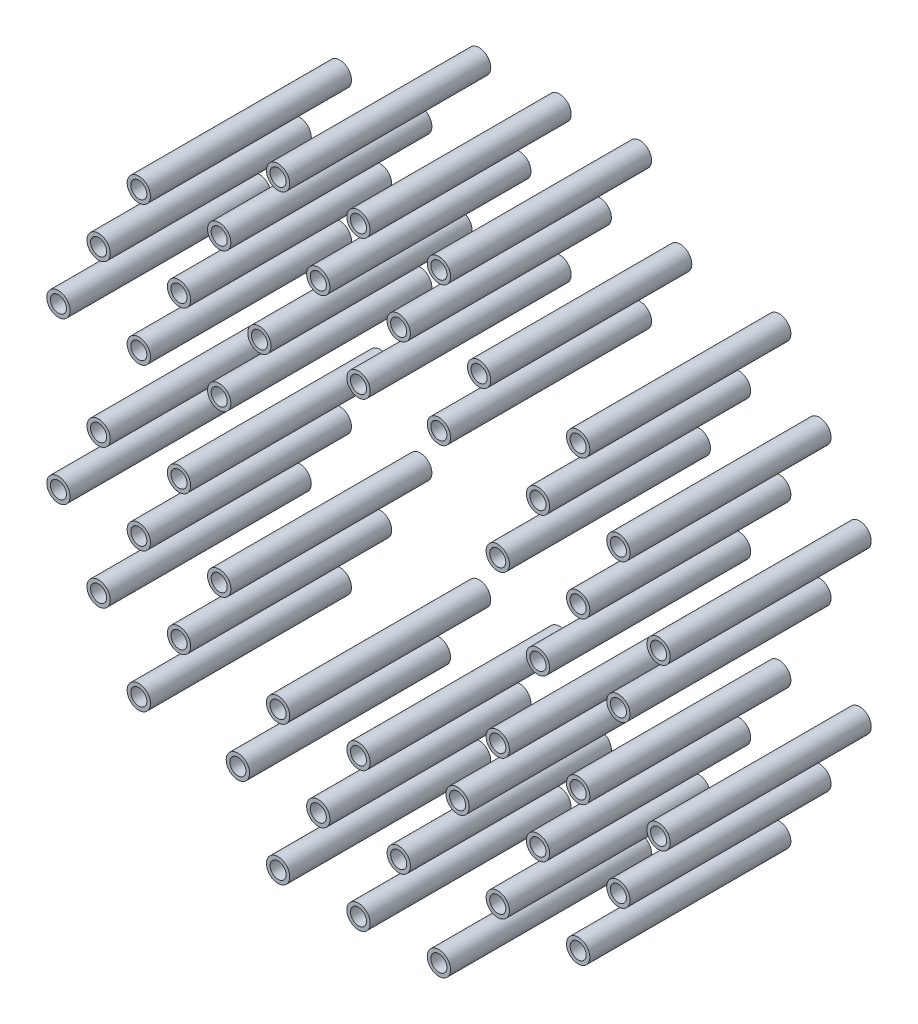
from build123d import *

# Parameters (mm, degrees)
SKETCH1_R             = 0.7366
SKETCH1_R_2           = 0.508
BOSS_EXTRUDE1_DEPTH   = 12.7
BOSS_EXTRUDE1_2_DEPTH = 12.7
BOSS_EXTRUDE1_3_DEPTH = 12.7
BOSS_EXTRUDE1_4_DEPTH = 12.7
BOSS_EXTRUDE1_5_DEPTH = 12.7
BOSS_EXTRUDE1_6_DEPTH = 12.7
BOSS_EXTRUDE1_7_DEPTH = 12.7
BOSS_EXTRUDE1_8_DEPTH = 12.7
CIRPATTERN2_COUNT     = 6


with BuildPart() as part:
    # Sketch1 → Boss-Extrude1 (new body)
    with BuildSketch(Plane.XY):
        with Locations((0, 10.16)):
            Circle(SKETCH1_R)
        with Locations((0, 10.16)):
            Circle(SKETCH1_R_2, mode=Mode.SUBTRACT)
    extrude(amount=BOSS_EXTRUDE1_DEPTH)


with BuildPart() as body_2:
    # Sketch1 → Boss-Extrude1 2 (new body)
    with BuildSketch(Plane.XY):
        with Locations((5.08, 10.16)):
            Circle(SKETCH1_R)
        with Locations((5.08, 10.16)):
            Circle(SKETCH1_R_2, mode=Mode.SUBTRACT)
    extrude(amount=BOSS_EXTRUDE1_2_DEPTH)


with BuildPart() as body_3:
    # Sketch1 → Boss-Extrude1 3 (new body)
    with BuildSketch(Plane.XY):
        with Locations((7.62, 14.559409051)):
            Circle(SKETCH1_R)
        with Locations((7.62, 14.559409051)):
            Circle(SKETCH1_R_2, mode=Mode.SUBTRACT)
    extrude(amount=BOSS_EXTRUDE1_3_DEPTH)


with BuildPart() as body_4:
    # Sketch1 → Boss-Extrude1 4 (new body)
    with BuildSketch(Plane.XY):
        with Locations((2.54, 14.559409051)):
            Circle(SKETCH1_R)
        with Locations((2.54, 14.559409051)):
            Circle(SKETCH1_R_2, mode=Mode.SUBTRACT)
    extrude(amount=BOSS_EXTRUDE1_4_DEPTH)


with BuildPart() as body_5:
    # Sketch1 → Boss-Extrude1 5 (new body)
    with BuildSketch(Plane.XY):
        with Locations((-2.54, 14.559409051)):
            Circle(SKETCH1_R)
        with Locations((-2.54, 14.559409051)):
            Circle(SKETCH1_R_2, mode=Mode.SUBTRACT)
    extrude(amount=BOSS_EXTRUDE1_5_DEPTH)


with BuildPart() as body_6:
    # Sketch1 → Boss-Extrude1 6 (new body)
    with BuildSketch(Plane.XY):
        with Locations((0, 18.958818102)):
            Circle(SKETCH1_R)
        with Locations((0, 18.958818102)):
            Circle(SKETCH1_R_2, mode=Mode.SUBTRACT)
    extrude(amount=BOSS_EXTRUDE1_6_DEPTH)


with BuildPart() as body_7:
    # Sketch1 → Boss-Extrude1 7 (new body)
    with BuildSketch(Plane.XY):
        with Locations((5.08, 18.958818102)):
            Circle(SKETCH1_R)
        with Locations((5.08, 18.958818102)):
            Circle(SKETCH1_R_2, mode=Mode.SUBTRACT)
    extrude(amount=BOSS_EXTRUDE1_7_DEPTH)


with BuildPart() as body_8:
    # Sketch1 → Boss-Extrude1 8 (new body)
    with BuildSketch(Plane.XY):
        with Locations((-5.08, 18.958818102)):
            Circle(SKETCH1_R)
        with Locations((-5.08, 18.958818102)):
            Circle(SKETCH1_R_2, mode=Mode.SUBTRACT)
    extrude(amount=BOSS_EXTRUDE1_8_DEPTH)


with BuildPart() as cirpattern2_1:
    # CirPattern2: pattern copy
    add(body_8.part.rotate(Axis((0, 0, 13.335), (0, 0, -1)), 1 * 360 / CIRPATTERN2_COUNT))


with BuildPart() as cirpattern2_2:
    # CirPattern2: pattern copy
    add(body_8.part.rotate(Axis((0, 0, 13.335), (0, 0, -1)), 2 * 360 / CIRPATTERN2_COUNT))


with BuildPart() as cirpattern2_3:
    # CirPattern2: pattern copy
    add(body_8.part.rotate(Axis((0, 0, 13.335), (0, 0, -1)), 3 * 360 / CIRPATTERN2_COUNT))


with BuildPart() as cirpattern2_4:
    # CirPattern2: pattern copy
    add(body_8.part.rotate(Axis((0, 0, 13.335), (0, 0, -1)), 4 * 360 / CIRPATTERN2_COUNT))


with BuildPart() as cirpattern2_5:
    # CirPattern2: pattern copy
    add(body_8.part.rotate(Axis((0, 0, 13.335), (0, 0, -1)), 5 * 360 / CIRPATTERN2_COUNT))


with BuildPart() as cirpattern2_6:
    # CirPattern2: pattern copy
    add(body_7.part.rotate(Axis((0, 0, 13.335), (0, 0, -1)), 1 * 360 / CIRPATTERN2_COUNT))


with BuildPart() as cirpattern2_7:
    # CirPattern2: pattern copy
    add(body_7.part.rotate(Axis((0, 0, 13.335), (0, 0, -1)), 2 * 360 / CIRPATTERN2_COUNT))


with BuildPart() as cirpattern2_8:
    # CirPattern2: pattern copy
    add(body_7.part.rotate(Axis((0, 0, 13.335), (0, 0, -1)), 3 * 360 / CIRPATTERN2_COUNT))


with BuildPart() as cirpattern2_9:
    # CirPattern2: pattern copy
    add(body_7.part.rotate(Axis((0, 0, 13.335), (0, 0, -1)), 4 * 360 / CIRPATTERN2_COUNT))


with BuildPart() as cirpattern2_10:
    # CirPattern2: pattern copy
    add(body_7.part.rotate(Axis((0, 0, 13.335), (0, 0, -1)), 5 * 360 / CIRPATTERN2_COUNT))


with BuildPart() as cirpattern2_11:
    # CirPattern2: pattern copy
    add(body_6.part.rotate(Axis((0, 0, 13.335), (0, 0, -1)), 1 * 360 / CIRPATTERN2_COUNT))


with BuildPart() as cirpattern2_12:
    # CirPattern2: pattern copy
    add(body_6.part.rotate(Axis((0, 0, 13.335), (0, 0, -1)), 2 * 360 / CIRPATTERN2_COUNT))


with BuildPart() as cirpattern2_13:
    # CirPattern2: pattern copy
    add(body_6.part.rotate(Axis((0, 0, 13.335), (0, 0, -1)), 3 * 360 / CIRPATTERN2_COUNT))


with BuildPart() as cirpattern2_14:
    # CirPattern2: pattern copy
    add(body_6.part.rotate(Axis((0, 0, 13.335), (0, 0, -1)), 4 * 360 / CIRPATTERN2_COUNT))


with BuildPart() as cirpattern2_15:
    # CirPattern2: pattern copy
    add(body_6.part.rotate(Axis((0, 0, 13.335), (0, 0, -1)), 5 * 360 / CIRPATTERN2_COUNT))


with BuildPart() as cirpattern2_16:
    # CirPattern2: pattern copy
    add(body_5.part.rotate(Axis((0, 0, 13.335), (0, 0, -1)), 1 * 360 / CIRPATTERN2_COUNT))


with BuildPart() as cirpattern2_17:
    # CirPattern2: pattern copy
    add(body_5.part.rotate(Axis((0, 0, 13.335), (0, 0, -1)), 2 * 360 / CIRPATTERN2_COUNT))


with BuildPart() as cirpattern2_18:
    # CirPattern2: pattern copy
    add(body_5.part.rotate(Axis((0, 0, 13.335), (0, 0, -1)), 3 * 360 / CIRPATTERN2_COUNT))


with BuildPart() as cirpattern2_19:
    # CirPattern2: pattern copy
    add(body_5.part.rotate(Axis((0, 0, 13.335), (0, 0, -1)), 4 * 360 / CIRPATTERN2_COUNT))


with BuildPart() as cirpattern2_20:
    # CirPattern2: pattern copy
    add(body_5.part.rotate(Axis((0, 0, 13.335), (0, 0, -1)), 5 * 360 / CIRPATTERN2_COUNT))


with BuildPart() as cirpattern2_21:
    # CirPattern2: pattern copy
    add(body_4.part.rotate(Axis((0, 0, 13.335), (0, 0, -1)), 1 * 360 / CIRPATTERN2_COUNT))


with BuildPart() as cirpattern2_22:
    # CirPattern2: pattern copy
    add(body_4.part.rotate(Axis((0, 0, 13.335), (0, 0, -1)), 2 * 360 / CIRPATTERN2_COUNT))


with BuildPart() as cirpattern2_23:
    # CirPattern2: pattern copy
    add(body_4.part.rotate(Axis((0, 0, 13.335), (0, 0, -1)), 3 * 360 / CIRPATTERN2_COUNT))


with BuildPart() as cirpattern2_24:
    # CirPattern2: pattern copy
    add(body_4.part.rotate(Axis((0, 0, 13.335), (0, 0, -1)), 4 * 360 / CIRPATTERN2_COUNT))


with BuildPart() as cirpattern2_25:
    # CirPattern2: pattern copy
    add(body_4.part.rotate(Axis((0, 0, 13.335), (0, 0, -1)), 5 * 360 / CIRPATTERN2_COUNT))


with BuildPart() as cirpattern2_26:
    # CirPattern2: pattern copy
    add(body_3.part.rotate(Axis((0, 0, 13.335), (0, 0, -1)), 1 * 360 / CIRPATTERN2_COUNT))


with BuildPart() as cirpattern2_27:
    # CirPattern2: pattern copy
    add(body_3.part.rotate(Axis((0, 0, 13.335), (0, 0, -1)), 2 * 360 / CIRPATTERN2_COUNT))


with BuildPart() as cirpattern2_28:
    # CirPattern2: pattern copy
    add(body_3.part.rotate(Axis((0, 0, 13.335), (0, 0, -1)), 3 * 360 / CIRPATTERN2_COUNT))


with BuildPart() as cirpattern2_29:
    # CirPattern2: pattern copy
    add(body_3.part.rotate(Axis((0, 0, 13.335), (0, 0, -1)), 4 * 360 / CIRPATTERN2_COUNT))


with BuildPart() as cirpattern2_30:
    # CirPattern2: pattern copy
    add(body_3.part.rotate(Axis((0, 0, 13.335), (0, 0, -1)), 5 * 360 / CIRPATTERN2_COUNT))


with BuildPart() as cirpattern2_31:
    # CirPattern2: pattern copy
    add(body_2.part.rotate(Axis((0, 0, 13.335), (0, 0, -1)), 1 * 360 / CIRPATTERN2_COUNT))


with BuildPart() as cirpattern2_32:
    # CirPattern2: pattern copy
    add(body_2.part.rotate(Axis((0, 0, 13.335), (0, 0, -1)), 2 * 360 / CIRPATTERN2_COUNT))


with BuildPart() as cirpattern2_33:
    # CirPattern2: pattern copy
    add(body_2.part.rotate(Axis((0, 0, 13.335), (0, 0, -1)), 3 * 360 / CIRPATTERN2_COUNT))


with BuildPart() as cirpattern2_34:
    # CirPattern2: pattern copy
    add(body_2.part.rotate(Axis((0, 0, 13.335), (0, 0, -1)), 4 * 360 / CIRPATTERN2_COUNT))


with BuildPart() as cirpattern2_35:
    # CirPattern2: pattern copy
    add(body_2.part.rotate(Axis((0, 0, 13.335), (0, 0, -1)), 5 * 360 / CIRPATTERN2_COUNT))


with BuildPart() as cirpattern2_36:
    # CirPattern2: pattern copy
    add(part.part.rotate(Axis((0, 0, 13.335), (0, 0, -1)), 1 * 360 / CIRPATTERN2_COUNT))


with BuildPart() as cirpattern2_37:
    # CirPattern2: pattern copy
    add(part.part.rotate(Axis((0, 0, 13.335), (0, 0, -1)), 2 * 360 / CIRPATTERN2_COUNT))


with BuildPart() as cirpattern2_38:
    # CirPattern2: pattern copy
    add(part.part.rotate(Axis((0, 0, 13.335), (0, 0, -1)), 3 * 360 / CIRPATTERN2_COUNT))


with BuildPart() as cirpattern2_39:
    # CirPattern2: pattern copy
    add(part.part.rotate(Axis((0, 0, 13.335), (0, 0, -1)), 4 * 360 / CIRPATTERN2_COUNT))


with BuildPart() as cirpattern2_40:
    # CirPattern2: pattern copy
    add(part.part.rotate(Axis((0, 0, 13.335), (0, 0, -1)), 5 * 360 / CIRPATTERN2_COUNT))


solid = Compound([part.part, body_2.part, body_3.part, body_4.part, body_5.part, body_6.part, body_7.part, body_8.part, cirpattern2_1.part, cirpattern2_2.part, cirpattern2_3.part, cirpattern2_4.part, cirpattern2_5.part, cirpattern2_6.part, cirpattern2_7.part, cirpattern2_8.part, cirpattern2_9.part, cirpattern2_10.part, cirpattern2_11.part, cirpattern2_12.part, cirpattern2_13.part, cirpattern2_14.part, cirpattern2_15.part, cirpattern2_16.part, cirpattern2_17.part, cirpattern2_18.part, cirpattern2_19.part, cirpattern2_20.part, cirpattern2_21.part, cirpattern2_22.part, cirpattern2_23.part, cirpattern2_24.part, cirpattern2_25.part, cirpattern2_26.part, cirpattern2_27.part, cirpattern2_28.part, cirpattern2_29.part, cirpattern2_30.part, cirpattern2_31.part, cirpattern2_32.part, cirpattern2_33.part, cirpattern2_34.part, cirpattern2_35.part, cirpattern2_36.part, cirpattern2_37.part, cirpattern2_38.part, cirpattern2_39.part, cirpattern2_40.part])
